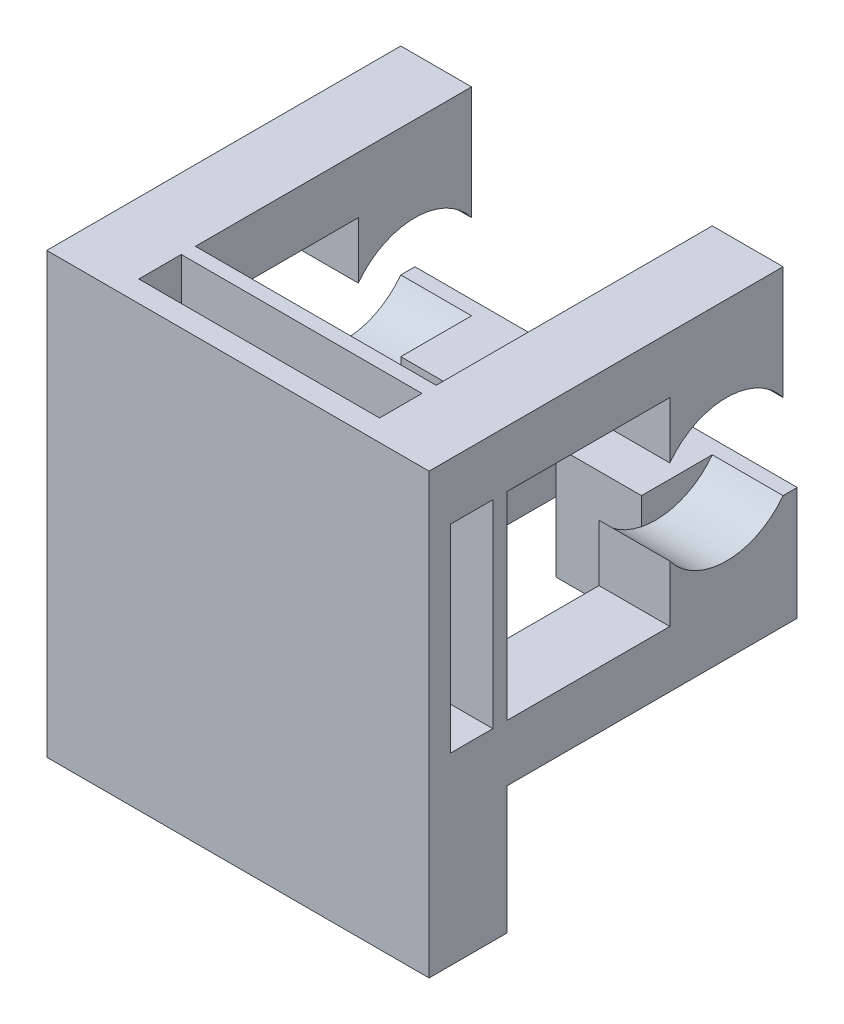
from build123d import *

# Parameters (mm, degrees)
SKETCH1_W           = 68.58
SKETCH1_H           = 55.88
BOSS_EXTRUDE1_DEPTH = 3.81
SKETCH2_W           = 12.7
SKETCH2_H           = 10.16
BOSS_EXTRUDE2_DEPTH = 59.69
SKETCH6_W           = 12.7
SKETCH6_H           = 20.32
BOSS_EXTRUDE3_DEPTH = 35.56
SKETCH4_R           = 12.7
CUT_EXTRUDE1_DEPTH  = 107.717790925
SKETCH7_W           = 68.58
SKETCH7_H           = 55.88
SKETCH7_W_2         = 43.18
SKETCH7_H_2         = 22.86
BOSS_EXTRUDE4_DEPTH = 2.54
SKETCH8_R           = 3.429
SKETCH8_R_2         = 7.493
CUT_EXTRUDE2_DEPTH  = 2.54
SKETCH9_W           = 68.58
SKETCH9_H           = 20.32
BOSS_EXTRUDE5_DEPTH = 2.54
CUT_EXTRUDE3_REACH  = 110.159
SKETCH10_W          = 12.446
SKETCH10_H          = 3.048
SKETCH11_W          = 15.367
SKETCH11_H          = 20.32
BOSS_EXTRUDE6_DEPTH = 12.7
BOSS_EXTRUDE7_DEPTH = 22.86


with BuildPart() as part:
    # Sketch1 → Boss-Extrude1 (new body)
    with BuildSketch(Plane.XY):
        with Locations((34.29, 27.94)):
            Rectangle(SKETCH1_W, SKETCH1_H)
    extrude(amount=BOSS_EXTRUDE1_DEPTH)

    # Sketch2 → Boss-Extrude2 (add)
    with BuildSketch(Plane(origin=(0, 0, 0), x_dir=(-1, 0, 0), z_dir=(0, 0, -1))):
        with Locations((-62.23, 50.8)):
            Rectangle(SKETCH2_W, SKETCH2_H)
        with Locations((-6.35, 50.8)):
            Rectangle(SKETCH2_W, SKETCH2_H)
        with Locations((-6.35, 5.08)):
            Rectangle(SKETCH2_W, SKETCH2_H)
        with Locations((-62.23, 5.08)):
            Rectangle(SKETCH2_W, SKETCH2_H)
    extrude(amount=BOSS_EXTRUDE2_DEPTH)

    # Sketch6 → Boss-Extrude3 (add)
    with BuildSketch(Plane(origin=(0, 10.16, 0), x_dir=(1, 0, 0), z_dir=(0, 1, 0))):
        with Locations((62.23, 49.53)):
            Rectangle(SKETCH6_W, SKETCH6_H)
        with Locations((6.35, 49.53)):
            Rectangle(SKETCH6_W, SKETCH6_H)
    extrude(amount=BOSS_EXTRUDE3_DEPTH)

    # Sketch4 → Cut-Extrude1 (cut, through all)
    with BuildSketch(Plane(origin=(68.58, 0, 0), x_dir=(0, 0, -1), z_dir=(1, 0, 0))):
        with Locations((49.53, 27.94)):
            Circle(SKETCH4_R)
    extrude(amount=-CUT_EXTRUDE1_DEPTH, mode=Mode.SUBTRACT)

    # Sketch7 → Boss-Extrude4 (add)
    with BuildSketch(Plane(origin=(0, 0, -7.62), x_dir=(-1, 0, 0), z_dir=(0, 0, -1))):
        with Locations((-34.29, 27.94)):
            Rectangle(SKETCH7_W, SKETCH7_H)
        with Locations((-34.29, -11.43)):
            Rectangle(SKETCH7_W_2, SKETCH7_H_2)
    extrude(amount=BOSS_EXTRUDE4_DEPTH)

    # Sketch8 → Cut-Extrude2 (cut)
    with BuildSketch(Plane(origin=(0, 0, -10.16), x_dir=(-1, 0, 0), z_dir=(0, 0, -1))):
        with Locations((-34.29, -10.16)):
            Circle(SKETCH8_R)
        with Locations((-34.29, 27.94)):
            Circle(SKETCH8_R_2)
    extrude(amount=-CUT_EXTRUDE2_DEPTH, mode=Mode.SUBTRACT)

    # Sketch9 → Boss-Extrude5 (add)
    with BuildSketch(Plane(origin=(0, 0, -59.69), x_dir=(-1, 0, 0), z_dir=(0, 0, -1))):
        with Locations((-34.29, 10.16)):
            Rectangle(SKETCH9_W, SKETCH9_H)
    extrude(amount=BOSS_EXTRUDE5_DEPTH)

    # Sketch10 → Cut-Extrude3 (cut, up to next)
    with BuildSketch(Plane.XZ, mode=Mode.PRIVATE) as cut_extrude3_sk1:
        with Locations((34.29, -59.69)):
            Rectangle(SKETCH10_W, SKETCH10_H)
    cut_extrude3_tool1 = extrude(cut_extrude3_sk1.sketch, amount=-CUT_EXTRUDE3_REACH, mode=Mode.PRIVATE) & part.part
    add(cut_extrude3_tool1.solids().sort_by_distance((34.29, 0, -59.69))[0], mode=Mode.SUBTRACT)

    # Sketch11 → Boss-Extrude6 (add)
    with BuildSketch(Plane.XY.offset(-59.69)):
        with Locations((20.3835, 10.16)):
            Rectangle(SKETCH11_W, SKETCH11_H)
        with Locations((48.1965, 10.16)):
            Rectangle(SKETCH11_W, SKETCH11_H)
    extrude(amount=BOSS_EXTRUDE6_DEPTH)

    # Sketch12 → Boss-Extrude7 (add)
    with BuildSketch(Plane.XZ):
        Polygon((12.7, -10.16), (0, -10.16), (0, 3.81), (68.58, 3.81), (68.58, -10.16), (55.88, -10.16), (55.88, 0), (12.7, 0), align=None)
    extrude(amount=BOSS_EXTRUDE7_DEPTH)


solid = part.part
